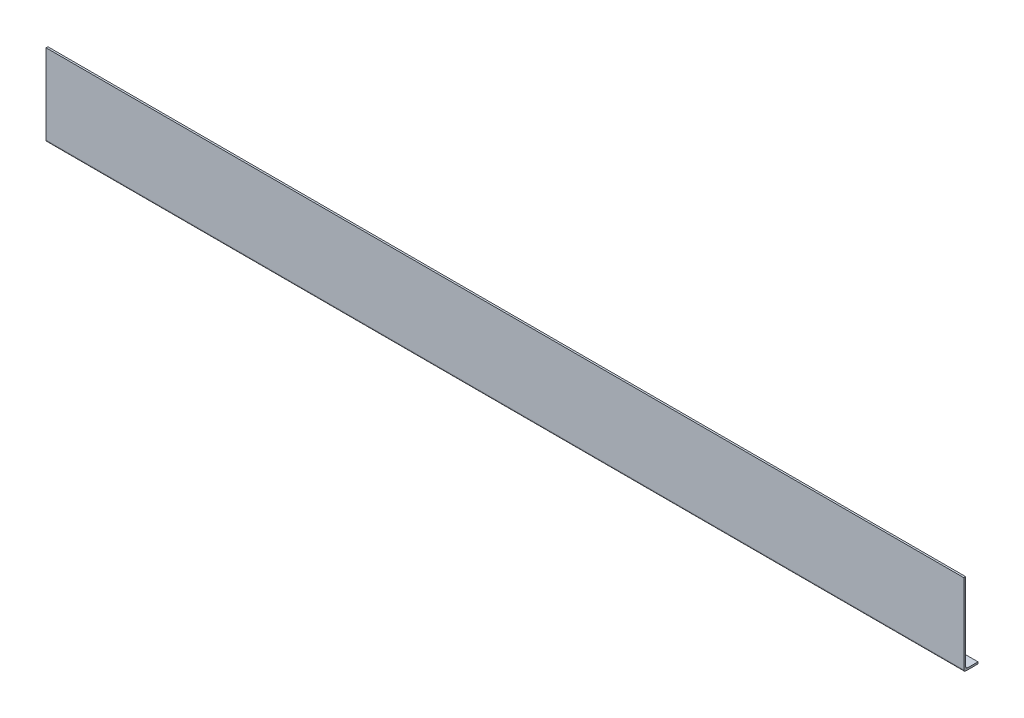
from build123d import *

# Parameters (mm, degrees)
BOSS_EXTRUDE1_DEPTH = 1493
FILLET1_R           = 3


with BuildPart() as part:
    # Sketch1 → Boss-Extrude1 (new body)
    with BuildSketch(Plane(origin=(0, 0, 0), x_dir=(0, 0, -1), z_dir=(1, 0, 0))):
        Polygon((0, 0), (-23, 0), (-23, 133), (-20, 133), (-20, 3), (0, 3), align=None)
    extrude(amount=BOSS_EXTRUDE1_DEPTH)

    # Fillet1
    fillet1_edges = [part.edges().sort_by_distance(p)[0] for p in [
        (746.5, 0, 23),
        (746.5, 3, 20),
    ]]
    fillet(fillet1_edges, radius=FILLET1_R)


solid = part.part
